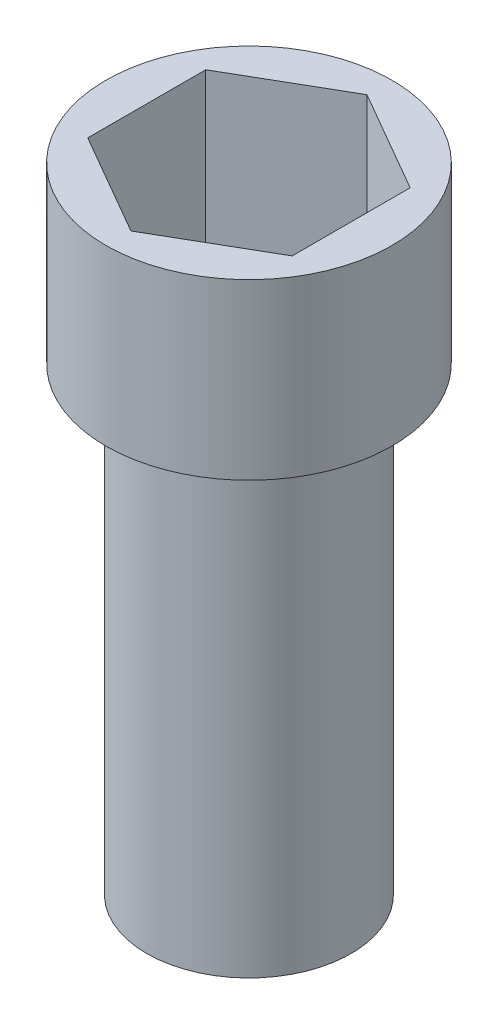
from build123d import *

# Parameters (mm, degrees)
SKETCH1_R           = 10
BOSS_EXTRUDE1_DEPTH = 45
SKETCH2_R           = 14
BOSS_EXTRUDE2_DEPTH = 17
CUT_EXTRUDE1_DEPTH  = 16.5


with BuildPart() as part:
    # Sketch1 → Boss-Extrude1 (new body)
    with BuildSketch(Plane(origin=(0, 0, 0), x_dir=(1, 0, 0), z_dir=(0, 1, 0))):
        with Locations(Location((0, 0, 0), (0, 0, 90))):
            Circle(SKETCH1_R)
    extrude(amount=BOSS_EXTRUDE1_DEPTH)

    # Sketch2 → Boss-Extrude2 (add)
    with BuildSketch(Plane(origin=(0, 45, 0), x_dir=(1, 0, 0), z_dir=(0, 1, 0))):
        with Locations(Location((0, 0, 0), (0, 0, 270))):
            Circle(SKETCH2_R)
    extrude(amount=BOSS_EXTRUDE2_DEPTH)

    # Sketch3 → Cut-Extrude1 (cut)
    with BuildSketch(Plane(origin=(0, 62, 0), x_dir=(1, 0, 0), z_dir=(0, 1, 0))):
        Polygon((0, 11.547005384), (-10, 5.773502692), (-10, -5.773502692), (0, -11.547005384), (10, -5.773502692), (10, 5.773502692), align=None)
    extrude(amount=-CUT_EXTRUDE1_DEPTH, mode=Mode.SUBTRACT)


solid = part.part
